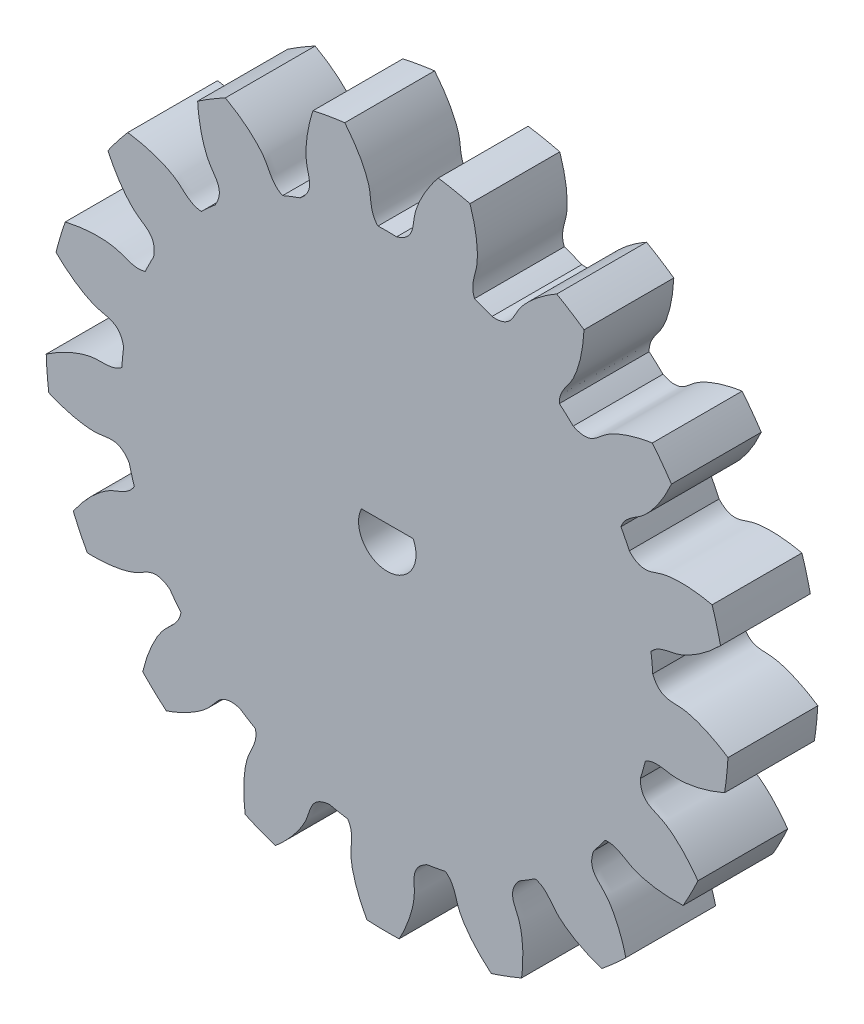
from build123d import *

# Parameters (mm, degrees)
SKETCH_1_R               = 19
EXTRUDE_1_DEPTH          = 30
CUT_EXTRUDE_1_DEPTH      = 41.274061131
PATTERN_CIRCULAR_1_COUNT = 17
CUT_EXTRUDE_2_DEPTH      = 41.269356352
CUT_EXTRUDE_2_DEPTH_BACK = 41.269356352
SKETCH_4_W               = 37.958446751
SKETCH_4_H               = 25
CUT_EXTRUDE_3_DEPTH      = 10


with BuildPart() as part:
    # 草图1 → 凸台-拉伸1 (new body)
    with BuildSketch(Plane.XY):
        Circle(SKETCH_1_R)
    extrude(amount=EXTRUDE_1_DEPTH)

    # 草图2 → 切除-拉伸1 (cut, through all)
    with BuildSketch(Plane.XY):
        with BuildLine():
            ThreePointArc((0.520115582, 14.791909624), (0, 14.801050994), (-0.520115582, 14.791909624))
            add(Edge.make_bspline(
                [(-0.520115582, 14.791909624), (-0.972191766, 15.253585809), (-0.879271626, 15.855655123), (-1.012195541, 16.427170192), (-1.025536125, 16.479822946), (-1.041621558, 16.538360434), (-1.060685765, 16.602692456), (-1.08296813, 16.672720523), (-1.108702737, 16.748339309), (-1.138121468, 16.829436297), (-1.171452801, 16.915891983), (-1.208921935, 17.007579923), (-1.250750506, 17.104366834), (-1.297156432, 17.206112677), (-1.348353729, 17.312670757), (-1.404552327, 17.423887825), (-1.465957901, 17.539604184), (-1.532771688, 17.659653794), (-1.605190329, 17.783864395), (-1.683405687, 17.912057615), (-1.767604693, 18.044049104), (-1.857969178, 18.17964865), (-1.954675716, 18.318660319), (-2.057895468, 18.460882586), (-2.167794029, 18.606108473), (-2.284531282, 18.754125694), (-2.408261247, 18.9047168), (-2.539131944, 19.057659333), (-2.677285252, 19.212725974), (-2.822856776, 19.369684704), (-2.975975717, 19.528298965), (-3.136764744, 19.688327821), (-3.305339868, 19.849526133), (-3.481810341, 20.011644706), (-3.666278473, 20.174430558), (-3.858839799, 20.337626706), (-4.059581877, 20.500973883), (-4.26858845, 20.664204749), (-4.485922849, 20.827067187), (-4.711691698, 20.989235128), (-4.945798311, 21.150654015), (-5.188894413, 21.310207923), (-5.551664348, 21.543505048), (-5.851937813, 21.696525858), (-6.00139186, 21.889941418)],
                knots=[0, 0, 0, 0, 0.178934842, 0.184107116, 0.189969026, 0.196520572, 0.203761756, 0.211692575, 0.220313031, 0.229623124, 0.239622853, 0.250312218, 0.26169122, 0.273759859, 0.286518134, 0.299966045, 0.314103593, 0.328930778, 0.344447598, 0.360654056, 0.37755015, 0.39513588, 0.413411247, 0.43237625, 0.45203089, 0.472375166, 0.493409079, 0.515132628, 0.537545814, 0.560648636, 0.584441094, 0.60892319, 0.634094921, 0.659956289, 0.686507294, 0.713747935, 0.741678212, 0.770298126, 0.799607677, 0.829606864, 0.860295687, 0.891674147, 0.923742244, 1, 1, 1, 1], degree=3))
            ThreePointArc((-6.00139186, 21.889941418), (0.252713573, 22.696307528), (6.487313599, 21.750885081))
            add(Edge.make_bspline(
                [(0.520115582, 14.791909624), (1.530874808, 15.092850346), (1.391069995, 15.782497537), (1.541026663, 16.427170032), (1.554366882, 16.479822997), (1.570452431, 16.538360418), (1.589516601, 16.602692461), (1.611798978, 16.672720522), (1.637533582, 16.74833931), (1.666952313, 16.829436297), (1.700283646, 16.915891983), (1.73775278, 17.007579923), (1.779581351, 17.104366834), (1.825987277, 17.206112677), (1.877184574, 17.312670757), (1.933383173, 17.423887825), (1.994788746, 17.539604184), (2.061602534, 17.659653794), (2.134021174, 17.783864395), (2.212236532, 17.912057615), (2.296435538, 18.044049104), (2.386800023, 18.17964865), (2.483506561, 18.318660319), (2.586726313, 18.460882586), (2.696624875, 18.606108473), (2.813362127, 18.754125694), (2.937092092, 18.9047168), (3.067962789, 19.057659333), (3.206116097, 19.212725974), (3.351687621, 19.369684704), (3.504806563, 19.528298964), (3.665595589, 19.688327821), (3.834170715, 19.84952613), (4.010641178, 20.011644719), (4.19510935, 20.174430509), (4.387670518, 20.337626899), (4.588413209, 20.500973135), (4.797417412, 20.664207643), (5.014760977, 20.827055997), (5.2404944, 20.989278362), (5.474737811, 21.150487095), (5.717306075, 21.310851892), (6.050895877, 21.519508277), (6.302899783, 21.676939106), (6.487313599, 21.750885081)],
                knots=[0, 0, 0, 0, 0.200836039, 0.205946756, 0.211738902, 0.218212477, 0.225367481, 0.233203913, 0.241721775, 0.250921065, 0.260801784, 0.271363933, 0.28260751, 0.294532516, 0.307138951, 0.320426815, 0.334396107, 0.349046829, 0.36437898, 0.380392559, 0.397087567, 0.414464005, 0.432521871, 0.451261166, 0.47068189, 0.490784043, 0.511567625, 0.533032636, 0.555179075, 0.578006944, 0.601516241, 0.625706968, 0.650579123, 0.676132707, 0.702367721, 0.729284163, 0.756882034, 0.785161333, 0.814122062, 0.84376422, 0.874087807, 0.905092822, 0.936779266, 1, 1, 1, 1], degree=3))
        make_face()
    cut_extrude_1 = extrude(amount=CUT_EXTRUDE_1_DEPTH, mode=Mode.SUBTRACT)

    # 阵列(圆周)1: 切除-拉伸1 ×17 about axis
    pattern_circular_1_axis = Axis((0, 0, -1.5), (0, 0, 1))
    for i in range(1, PATTERN_CIRCULAR_1_COUNT):
        add(cut_extrude_1.rotate(pattern_circular_1_axis, i * 360 / PATTERN_CIRCULAR_1_COUNT), mode=Mode.SUBTRACT)

    # 草图4 → 切除-拉伸2 (cut, two sides: drawn at the far end of the back side and taken through both)
    with BuildSketch(Plane(origin=(0, 0, 0), x_dir=(1, 0, 0), z_dir=(0, 1, 0)).offset(-CUT_EXTRUDE_2_DEPTH_BACK)):
        with Locations((-0.010793985, -17.5)):
            Rectangle(SKETCH_4_W, SKETCH_4_H)
    extrude(amount=CUT_EXTRUDE_2_DEPTH + CUT_EXTRUDE_2_DEPTH_BACK, mode=Mode.SUBTRACT)

    # 草图5 → 切除-拉伸3 (cut)
    with BuildSketch(Plane.XY.offset(5)):
        with BuildLine():
            Line((1.438749457, 0.7), (-1.438749457, 0.7))
            ThreePointArc((-1.438749457, 0.7), (0, -1.6), (1.438749457, 0.7))
        make_face()
    extrude(amount=-CUT_EXTRUDE_3_DEPTH, mode=Mode.SUBTRACT)


solid = part.part
